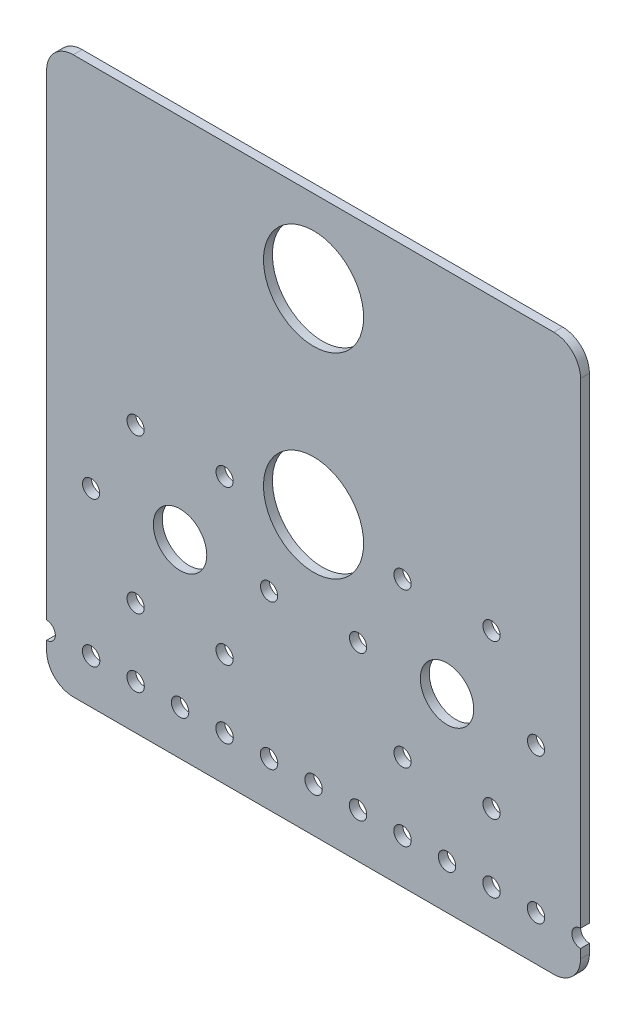
from build123d import *

# Parameters (mm, degrees)
SKETCH1_R           = 2.4892
SKETCH1_R_2         = 2.4511
SKETCH1_R_3         = 7.62
SKETCH1_R_4         = 14.2875
BOSS_EXTRUDE1_DEPTH = 2.54
FILLET1_R           = 7.62


with BuildPart() as part:
    # Sketch1 → Boss-Extrude1 (new body)
    with BuildSketch(Plane.XY):
        with BuildLine():
            Line((-76.2, -15.1892), (-76.2, -25.4))
            Line((-76.2, -25.4), (76.2, -25.4))
            Line((76.2, -25.4), (76.2, -15.1892))
            ThreePointArc((76.2, -15.1892), (73.7108, -12.7), (76.2, -10.2108))
            Line((76.2, -10.2108), (76.2, 133.35))
            Line((76.2, 133.35), (-76.2, 133.35))
            Line((-76.2, 133.35), (-76.2, -10.2108))
            ThreePointArc((-76.2, -10.2108), (-73.7108, -12.7), (-76.2, -15.1892))
        make_face()
        with Locations((-63.5, -12.7)):
            Circle(SKETCH1_R, mode=Mode.SUBTRACT)
        with Locations((-50.8, -12.7)):
            Circle(SKETCH1_R, mode=Mode.SUBTRACT)
        with Locations((-38.1, -12.7)):
            Circle(SKETCH1_R, mode=Mode.SUBTRACT)
        with Locations((-50.8, 6.705273841)):
            Circle(SKETCH1_R_2, mode=Mode.SUBTRACT)
        with Locations((-25.4, -12.7)):
            Circle(SKETCH1_R, mode=Mode.SUBTRACT)
        with Locations((-12.7, -12.7)):
            Circle(SKETCH1_R, mode=Mode.SUBTRACT)
        with Locations((-25.4, 6.705273841)):
            Circle(SKETCH1_R_2, mode=Mode.SUBTRACT)
        with Locations((-63.5, 28.702319097)):
            Circle(SKETCH1_R_2, mode=Mode.SUBTRACT)
        with Locations((-38.1, 28.702319097)):
            Circle(SKETCH1_R_3, mode=Mode.SUBTRACT)
        with Locations((-50.8, 50.699364354)):
            Circle(SKETCH1_R_2, mode=Mode.SUBTRACT)
        with Locations((-12.7, 28.702319097)):
            Circle(SKETCH1_R_2, mode=Mode.SUBTRACT)
        with Locations((-25.4, 50.699364354)):
            Circle(SKETCH1_R_2, mode=Mode.SUBTRACT)
        with Locations((0, -12.7)):
            Circle(SKETCH1_R, mode=Mode.SUBTRACT)
        with Locations((12.7, -12.7)):
            Circle(SKETCH1_R, mode=Mode.SUBTRACT)
        with Locations((25.4, -12.7)):
            Circle(SKETCH1_R, mode=Mode.SUBTRACT)
        with Locations((25.4, 6.705273841)):
            Circle(SKETCH1_R_2, mode=Mode.SUBTRACT)
        with Locations((38.1, -12.7)):
            Circle(SKETCH1_R, mode=Mode.SUBTRACT)
        with Locations((50.8, -12.7)):
            Circle(SKETCH1_R, mode=Mode.SUBTRACT)
        with Locations((63.5, -12.7)):
            Circle(SKETCH1_R, mode=Mode.SUBTRACT)
        with Locations((50.8, 6.705273841)):
            Circle(SKETCH1_R_2, mode=Mode.SUBTRACT)
        with Locations((12.7, 28.702319097)):
            Circle(SKETCH1_R_2, mode=Mode.SUBTRACT)
        with Locations((0, 53.975)):
            Circle(SKETCH1_R_4, mode=Mode.SUBTRACT)
        with Locations((25.4, 50.699364354)):
            Circle(SKETCH1_R_2, mode=Mode.SUBTRACT)
        with Locations((38.1, 28.702319097)):
            Circle(SKETCH1_R_3, mode=Mode.SUBTRACT)
        with Locations((63.5, 28.702319097)):
            Circle(SKETCH1_R_2, mode=Mode.SUBTRACT)
        with Locations((50.8, 50.699364354)):
            Circle(SKETCH1_R_2, mode=Mode.SUBTRACT)
        with Locations((0, 109.855)):
            Circle(SKETCH1_R_4, mode=Mode.SUBTRACT)
    extrude(amount=BOSS_EXTRUDE1_DEPTH)

    # Fillet1
    fillet1_edges = [part.edges().sort_by_distance(p)[0] for p in [
        (-76.2, 133.35, 1.27),
        (76.2, 133.35, 1.27),
        (76.2, -25.4, 1.27),
        (-76.2, -25.4, 1.27),
    ]]
    fillet(fillet1_edges, radius=FILLET1_R)


solid = part.part
